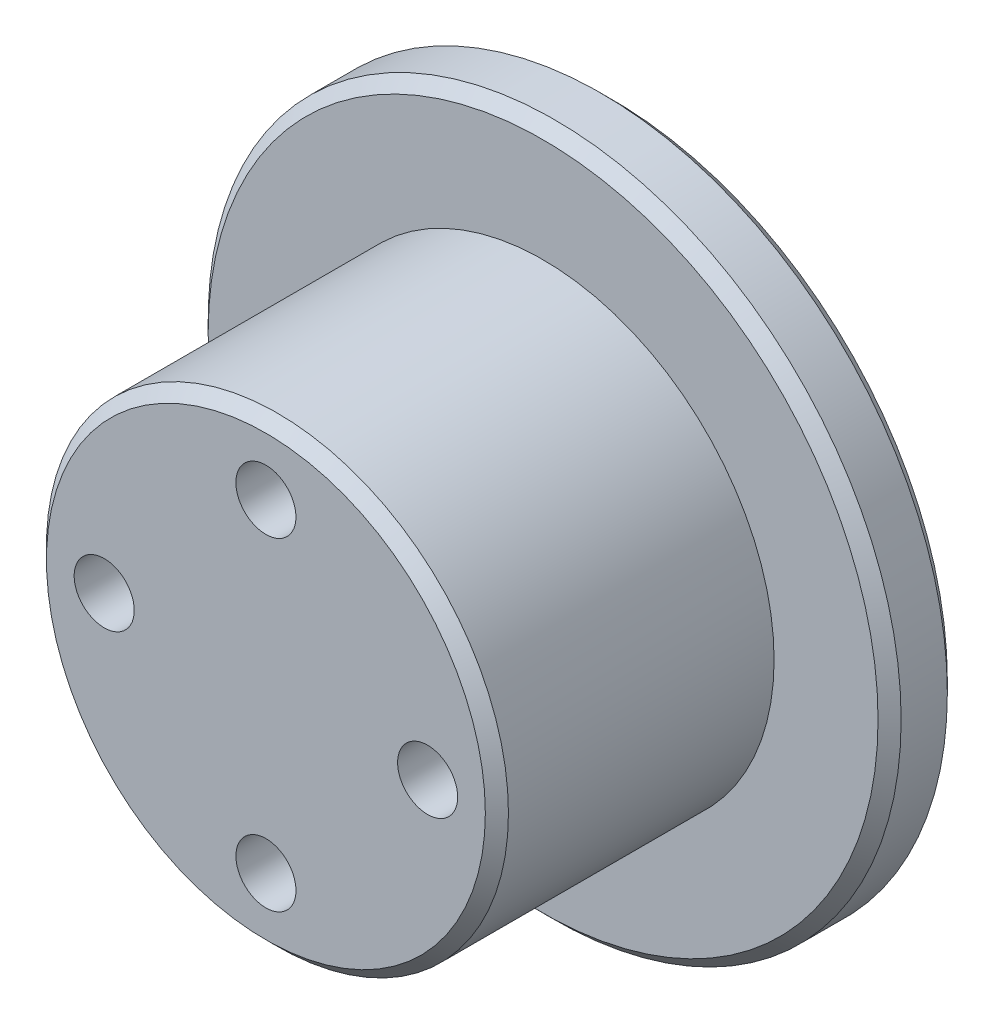
from build123d import *

# Parameters (mm, degrees)
SKETCH_1_R          = 15
EXTRUDE_1_DEPTH     = 3
SKETCH_2_R          = 10
EXTRUDE_2_DEPTH     = 12
SKETCH_3_R          = 1.3
CUT_EXTRUDE_1_DEPTH = 6
SKETCH_4_R          = 2
CUT_EXTRUDE_2_DEPTH = 6
CHAMFER_1_SIZE      = 0.5


with BuildPart() as part:
    # 草图1 → 凸台-拉伸1 (new body)
    with BuildSketch(Plane.XY):
        Circle(SKETCH_1_R)
    extrude(amount=EXTRUDE_1_DEPTH)

    # 草图2 → 凸台-拉伸2 (add)
    with BuildSketch(Plane.XY.offset(3)):
        Circle(SKETCH_2_R)
    extrude(amount=EXTRUDE_2_DEPTH)

    # 草图3 → 切除-拉伸1 (cut)
    with BuildSketch(Plane.XY.offset(15)):
        with Locations((-6.999, -0.001)):
            Circle(SKETCH_3_R)
        with Locations((0, 7)):
            Circle(SKETCH_3_R)
        with Locations((0.002, -7)):
            Circle(SKETCH_3_R)
        with Locations((7.001, 0.001)):
            Circle(SKETCH_3_R)
    extrude(amount=-CUT_EXTRUDE_1_DEPTH, mode=Mode.SUBTRACT)

    # 草图4 → 切除-拉伸2 (cut)
    with BuildSketch(Plane(origin=(0, 0, 0), x_dir=(-1, 0, 0), z_dir=(0, 0, -1))):
        with Locations((0, -5)):
            Circle(SKETCH_4_R)
        with Locations((-4.328627019, 2.500866025)):
            Circle(SKETCH_4_R)
        with Locations((4.331627019, 2.499133975)):
            Circle(SKETCH_4_R)
    extrude(amount=-CUT_EXTRUDE_2_DEPTH, mode=Mode.SUBTRACT)

    # 倒角1
    chamfer_1_edges = [part.edges().sort_by_distance(p)[0] for p in [
        (-15, 0, 0),
        (-15, 0, 3),
        (-10, 0, 15),
    ]]
    chamfer(chamfer_1_edges, length=CHAMFER_1_SIZE)


solid = part.part
